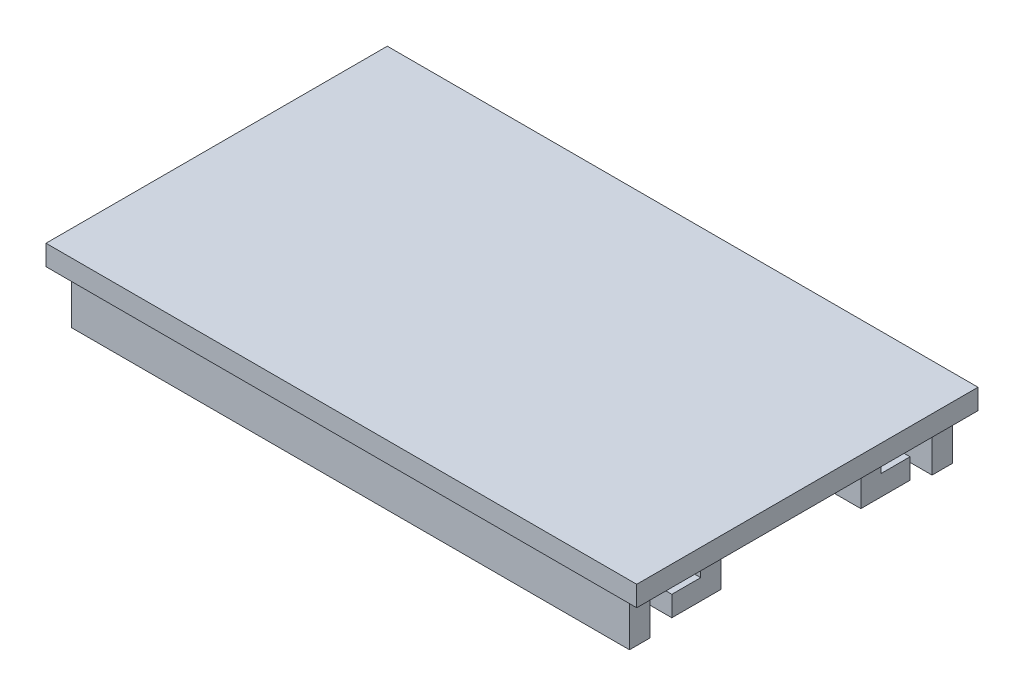
from build123d import *

# Parameters (mm, degrees)
SKETCH1_W           = 180
SKETCH1_H           = 104
BOSS_EXTRUDE1_DEPTH = 6.2
BOSS_EXTRUDE2_START = 5
SKETCH3_W           = 6.2
SKETCH3_H           = 15
BOSS_EXTRUDE2_DEPTH = 170


with BuildPart() as part:
    # Sketch1 → Boss-Extrude1 (new body)
    with BuildSketch(Plane(origin=(0, 0, 0), x_dir=(1, 0, 0), z_dir=(0, 1, 0))):
        Rectangle(SKETCH1_W, SKETCH1_H)
    extrude(amount=BOSS_EXTRUDE1_DEPTH)

    # Sketch3 → Boss-Extrude2 (add)
    with BuildSketch(Plane.ZY.offset(-90).offset(BOSS_EXTRUDE2_START)):
        with Locations((46.1, -7.5)):
            Rectangle(SKETCH3_W, SKETCH3_H)
        Polygon((36.3, -6.8), (27.5, -6.8), (27.5, 0), (21.3, 0), (21.3, -13), (36.3, -13), align=None)
        Polygon((-21.3, -13), (-21.3, 0), (-27.5, 0), (-27.5, -6.8), (-36.3, -6.8), (-36.3, -13), align=None)
        with Locations((-46.1, -7.5)):
            Rectangle(SKETCH3_W, SKETCH3_H)
    extrude(amount=BOSS_EXTRUDE2_DEPTH)


solid = part.part
